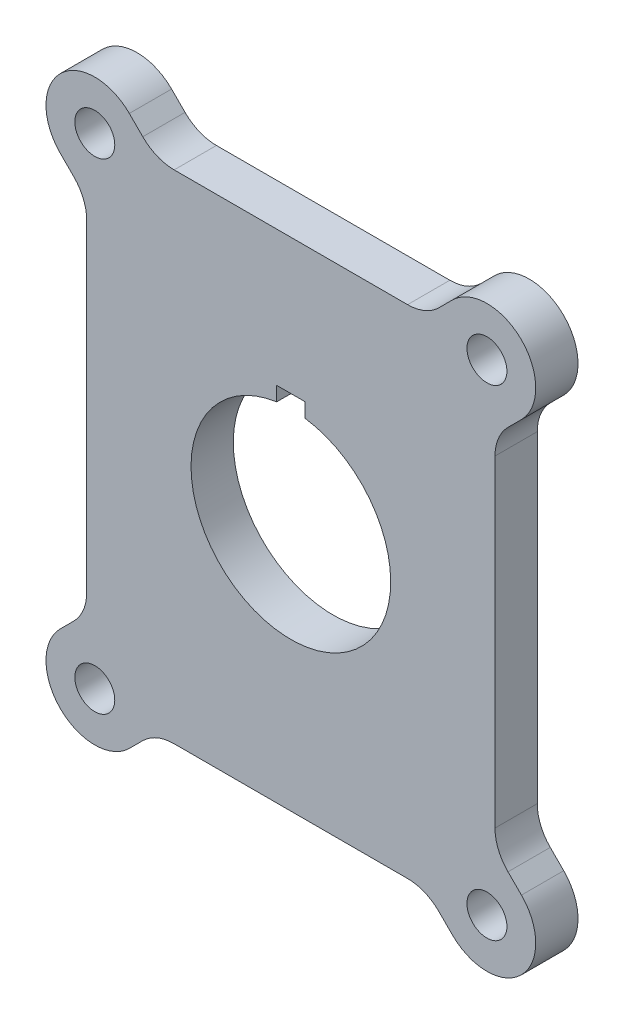
from build123d import *

# Parameters (mm, degrees)
BOSS_EXTRUDE1_DEPTH  = 4.7625
M4_CLEARANCE_HOLE2_D = 4.5


with BuildPart() as part:
    # Sketch4 → Boss-Extrude1 (new body)
    with BuildSketch(Plane.XY.offset(-59.668926648)):
        with BuildLine():
            Line((5.401994847, 39.710959692), (-20.899520343, 39.710959692))
            ThreePointArc((-20.899520343, 39.710959692), (-22.812937505, 40.091562029), (-24.435054249, 41.175425786))
            Line((-24.435054249, 41.175425786), (-25.951045701, 42.691417238))
            ThreePointArc((-25.951045701, 42.691417238), (-33.729220295, 42.691417238), (-33.729220295, 34.913242645))
            Line((-33.729220295, 34.913242645), (-32.213228842, 33.397251193))
            ThreePointArc((-32.213228842, 33.397251193), (-31.129365086, 31.775134449), (-30.748762748, 29.861717287))
            Line((-30.748762748, 29.861717287), (-30.748762748, -6.439797903))
            ThreePointArc((-30.748762748, -6.439797903), (-31.129365086, -8.353215065), (-32.213228842, -9.975331809))
            Line((-32.213228842, -9.975331809), (-33.729220295, -11.491323262))
            ThreePointArc((-33.729220295, -11.491323262), (-33.729220295, -19.269497855), (-25.951045701, -19.269497855))
            Line((-25.951045701, -19.269497855), (-24.435054249, -17.753506402))
            ThreePointArc((-24.435054249, -17.753506402), (-22.812937505, -16.669642646), (-20.899520343, -16.289040308))
            Line((-20.899520343, -16.289040308), (5.401994847, -16.289040308))
            ThreePointArc((5.401994847, -16.289040308), (7.315412009, -16.669642646), (8.937528753, -17.753506402))
            Line((8.937528753, -17.753506402), (10.453520205, -19.269497855))
            ThreePointArc((10.453520205, -19.269497855), (18.231694798, -19.269497855), (18.231694798, -11.491323262))
            Line((18.231694798, -11.491323262), (16.715703346, -9.975331809))
            ThreePointArc((16.715703346, -9.975331809), (15.631839589, -8.353215065), (15.251237252, -6.439797903))
            Line((15.251237252, -6.439797903), (15.251237252, 29.861717287))
            ThreePointArc((15.251237252, 29.861717287), (15.631839589, 31.775134449), (16.715703346, 33.397251193))
            Line((16.715703346, 33.397251193), (18.231694798, 34.913242645))
            ThreePointArc((18.231694798, 34.913242645), (18.231694798, 42.691417238), (10.453520205, 42.691417238))
            Line((10.453520205, 42.691417238), (8.937528753, 41.175425786))
            ThreePointArc((8.937528753, 41.175425786), (7.315412009, 40.091562029), (5.401994847, 39.710959692))
        make_face()
        with BuildLine():
            Line((-6.148762748, 22.84660067), (-6.148762748, 24.460959692))
            Line((-6.148762748, 24.460959692), (-9.348762748, 24.460959692))
            Line((-9.348762748, 24.460959692), (-9.348762748, 22.84660067))
            ThreePointArc((-9.348762748, 22.84660067), (-7.748762748, 0.460959692), (-6.148762748, 22.84660067))
        make_face(mode=Mode.SUBTRACT)
    extrude(amount=BOSS_EXTRUDE1_DEPTH)

    # M4 Clearance Hole2 (through all)
    with Locations(Plane.XY.offset(-54.906426648)):
        with Locations((-29.840132998, 38.802329941), (14.342607502, 38.802329941), (14.342607502, -15.380410558), (-29.840132998, -15.380410558)):
            Hole(M4_CLEARANCE_HOLE2_D / 2)


solid = part.part
